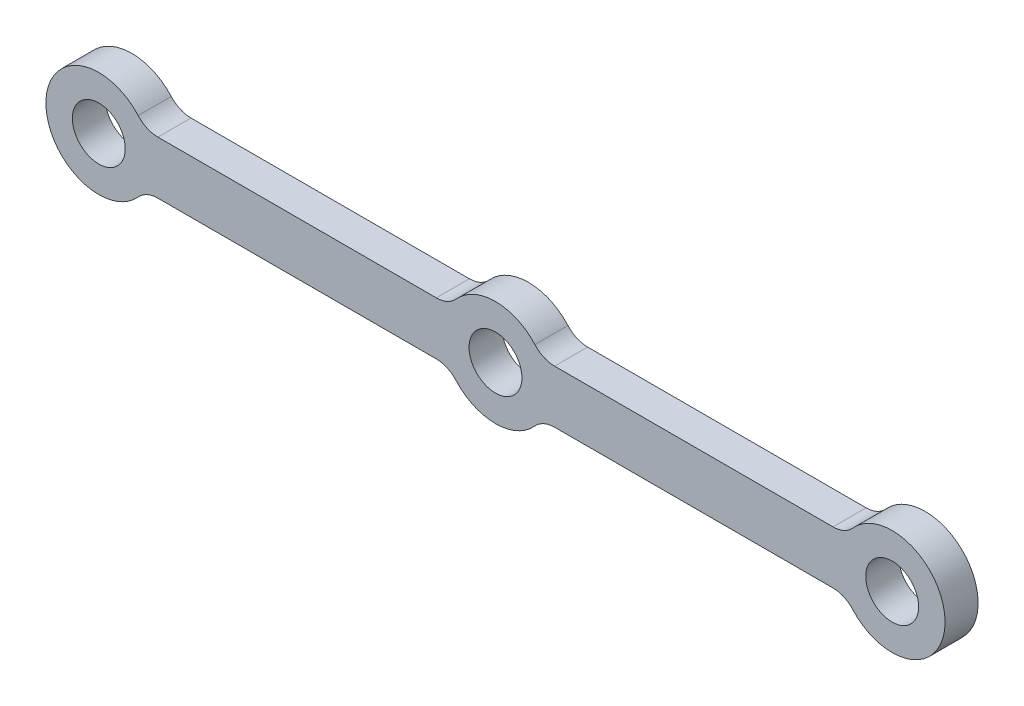
from build123d import *

# Parameters (mm, degrees)
SKETCH1_R               = 5.08
SKETCH1_W               = 76.2
SKETCH1_H               = 5.08
BOSS_EXTRUDE1_DEPTH     = 3.175
CUT_EXTRUDE1_DEPTH      = 82.698123754
CUT_EXTRUDE1_DEPTH_BACK = 82.698123754
SKETCH2_R               = 2.54
FILLET1_R               = 2.54


with BuildPart() as part:
    # Sketch1 → Boss-Extrude1 (new body)
    with BuildSketch(Plane.XY):
        with Locations((0, 2.54)):
            Circle(SKETCH1_R)
        with Locations((76.2, 2.54)):
            Circle(SKETCH1_R)
        with Locations((38.1, 2.54)):
            Circle(SKETCH1_R)
        with Locations((38.1, 2.54)):
            Rectangle(SKETCH1_W, SKETCH1_H)
    extrude(amount=BOSS_EXTRUDE1_DEPTH)

    # Sketch2 → Cut-Extrude1 (cut, two sides: drawn at the far end of the back side and taken through both)
    with BuildSketch(Plane.XY.offset(3.175).offset(-CUT_EXTRUDE1_DEPTH_BACK)):
        with Locations((0, 2.54)):
            Circle(SKETCH2_R)
        with Locations((76.2, 2.54)):
            Circle(SKETCH2_R)
        with Locations((38.1, 2.54)):
            Circle(SKETCH2_R)
    extrude(amount=CUT_EXTRUDE1_DEPTH + CUT_EXTRUDE1_DEPTH_BACK, mode=Mode.SUBTRACT)

    # Fillet1
    fillet1_edges = [part.edges().sort_by_distance(p)[0] for p in [
        (4.399409051, 5.08, 1.5875),
        (33.700590949, 5.08, 1.5875),
        (42.499409051, 5.08, 1.5875),
        (71.800590949, 5.08, 1.5875),
        (71.800590949, 0, 1.5875),
        (4.399409051, 0, 1.5875),
        (33.700590949, 0, 1.5875),
        (42.499409051, 0, 1.5875),
    ]]
    fillet(fillet1_edges, radius=FILLET1_R)


solid = part.part
